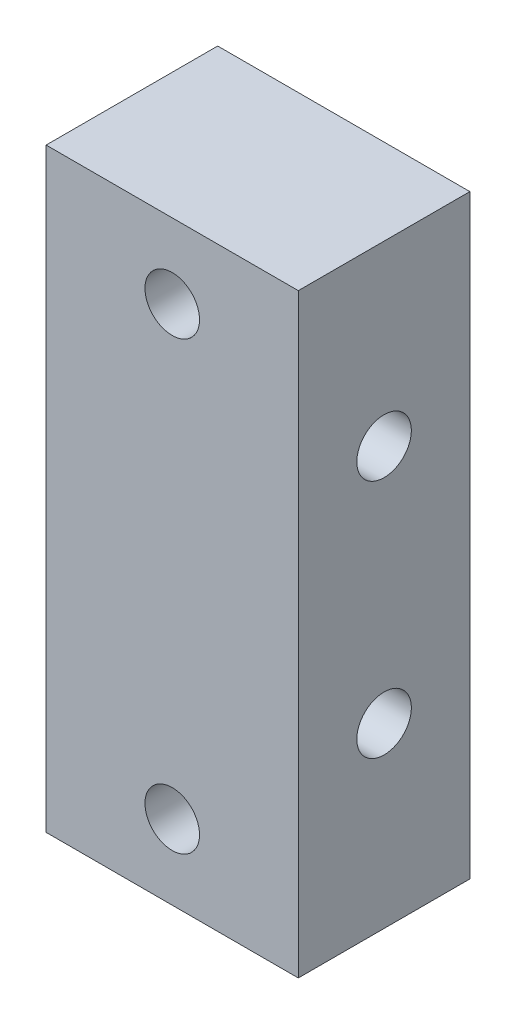
from build123d import *

# Parameters (mm, degrees)
SKETCH1_W                      = 18.669
SKETCH1_H                      = 44.069
BOSS_EXTRUDE1_DEPTH            = 12.7
TAP_DRILL_FOR_10_32_TAP1_D     = 4.0386
TAP_DRILL_FOR_10_32_TAP2_D     = 4.0386
TAP_DRILL_FOR_10_32_TAP2_DEPTH = 6.35
TAP_DRILL_FOR_10_32_TAP2_TIP   = 1.213317848


with BuildPart() as part:
    # Sketch1 → Boss-Extrude1 (new body)
    with BuildSketch(Plane.XY):
        Rectangle(SKETCH1_W, SKETCH1_H)
    extrude(amount=BOSS_EXTRUDE1_DEPTH)

    # Tap Drill for #10-32 Tap1 (through all)
    with Locations(Plane(origin=(9.3345, 0, 0), x_dir=(0, 0, -1), z_dir=(1, 0, 0))):
        with Locations((-6.35, 8.89), (-6.35, -8.89)):
            Hole(TAP_DRILL_FOR_10_32_TAP1_D / 2)

    # Tap Drill for #10-32 Tap2
    with Locations(Plane.XY.offset(12.7)):
        with Locations((0, 16.51), (0, -16.51)):
            Hole(TAP_DRILL_FOR_10_32_TAP2_D / 2, depth=TAP_DRILL_FOR_10_32_TAP2_DEPTH)
            with Locations((0, 0, -(TAP_DRILL_FOR_10_32_TAP2_DEPTH + TAP_DRILL_FOR_10_32_TAP2_TIP / 2))):  # 118° drill point
                Cone(0, TAP_DRILL_FOR_10_32_TAP2_D / 2, TAP_DRILL_FOR_10_32_TAP2_TIP, mode=Mode.SUBTRACT)


solid = part.part
